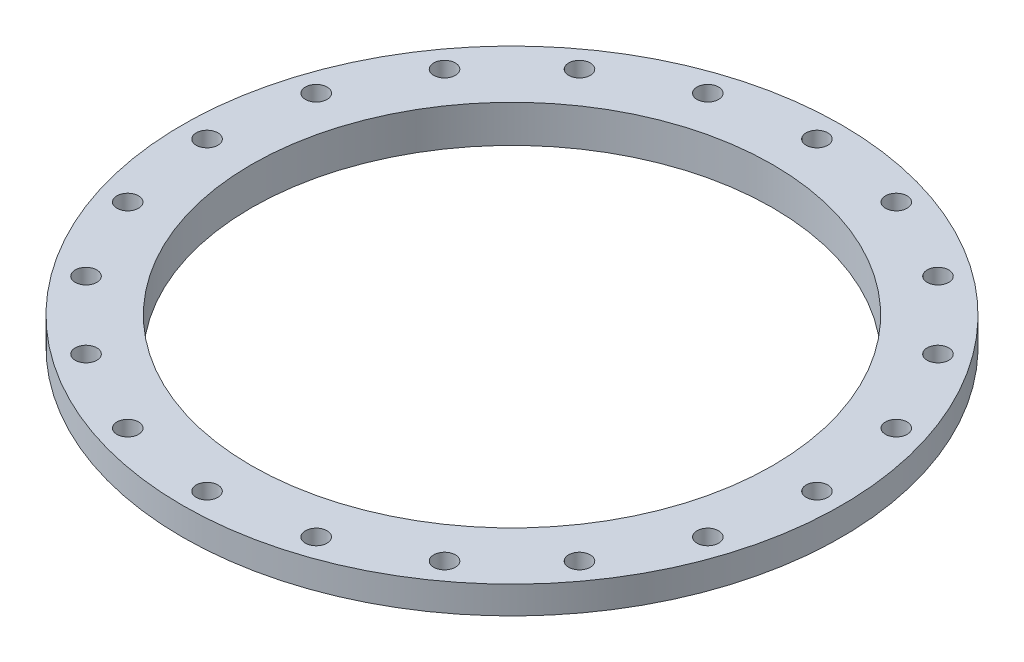
from build123d import *

# Parameters (mm, degrees)
CUT_EXTRUDE1_DEPTH      = 475.588242585
CUT_EXTRUDE1_DEPTH_BACK = 475.588242585
SKETCH2_R               = 11


with BuildPart() as part:
    # Sketch1 → Revolve1 (revolve)
    with BuildSketch(Plane(origin=(0, 0, 0), x_dir=(0, 0, -1), z_dir=(1, 0, 0))):
        Polygon((-335, 19), (-335, -9), (-296.139702343, -9), (-292.5, -19), (-265, -19), (-265, 19), align=None)
    revolve(axis=Axis((0, 1813.316593342, 0), (0, -1, 0)))

    # Sketch2 → Cut-Extrude1 (cut, two sides: drawn at the far end of the back side and taken through both)
    with BuildSketch(Plane.XZ.offset(9).offset(-CUT_EXTRUDE1_DEPTH_BACK)):
        with Locations(Location((0, 310, 0), (0, 0, 270))):
            Circle(SKETCH2_R)
        with Locations(Location((95.795268256, 294.827520051, 0), (0, 0, 270))):
            Circle(SKETCH2_R)
        with Locations(Location((182.213428211, 250.795268256, 0), (0, 0, 270))):
            Circle(SKETCH2_R)
        with Locations(Location((250.795268256, 182.213428211, 0), (0, 0, 270))):
            Circle(SKETCH2_R)
        with Locations(Location((294.827520052, 95.795268256, 0), (0, 0, 270))):
            Circle(SKETCH2_R)
        with Locations(Location((310, 0, 0), (0, 0, 270))):
            Circle(SKETCH2_R)
        with Locations(Location((294.827520052, -95.795268256, 0), (0, 0, 270))):
            Circle(SKETCH2_R)
        with Locations(Location((250.795268256, -182.213428211, 0), (0, 0, 270))):
            Circle(SKETCH2_R)
        with Locations(Location((182.213428211, -250.795268256, 0), (0, 0, 270))):
            Circle(SKETCH2_R)
        with Locations(Location((95.795268256, -294.827520052, 0), (0, 0, 270))):
            Circle(SKETCH2_R)
        with Locations(Location((0, -310, 0), (0, 0, 270))):
            Circle(SKETCH2_R)
        with Locations(Location((-95.795268256, -294.827520052, 0), (0, 0, 270))):
            Circle(SKETCH2_R)
        with Locations(Location((-182.213428211, -250.795268256, 0), (0, 0, 270))):
            Circle(SKETCH2_R)
        with Locations(Location((-250.795268256, -182.213428211, 0), (0, 0, 270))):
            Circle(SKETCH2_R)
        with Locations(Location((-294.827520051, -95.795268256, 0), (0, 0, 270))):
            Circle(SKETCH2_R)
        with Locations(Location((-310, 0, 0), (0, 0, 270))):
            Circle(SKETCH2_R)
        with Locations(Location((-294.827520051, 95.795268256, 0), (0, 0, 270))):
            Circle(SKETCH2_R)
        with Locations(Location((-250.795268256, 182.213428211, 0), (0, 0, 270))):
            Circle(SKETCH2_R)
        with Locations(Location((-182.213428211, 250.795268256, 0), (0, 0, 270))):
            Circle(SKETCH2_R)
        with Locations(Location((-95.795268256, 294.827520051, 0), (0, 0, 270))):
            Circle(SKETCH2_R)
    extrude(amount=CUT_EXTRUDE1_DEPTH + CUT_EXTRUDE1_DEPTH_BACK, mode=Mode.SUBTRACT)


solid = part.part
